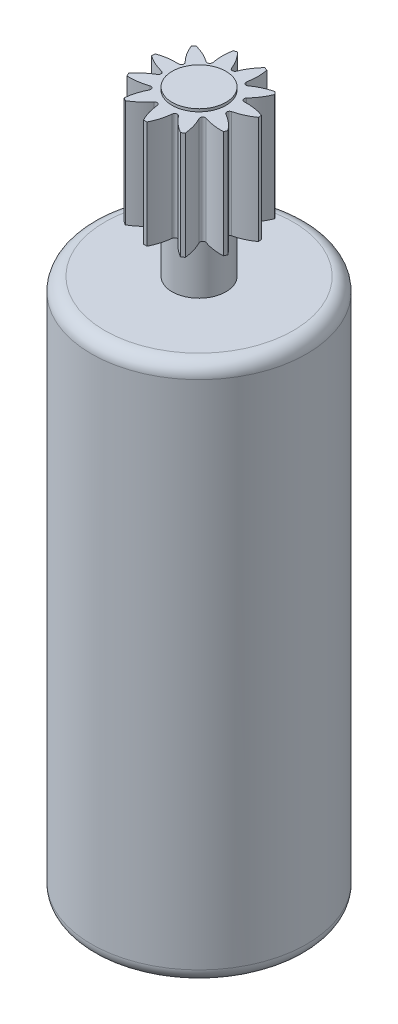
from build123d import *

# Parameters (mm, degrees)
FILLET1_R          = 0.5
CUT_EXTRUDE1_START = -4
CUT_EXTRUDE1_DEPTH = 4
CIRPATTERN2_COUNT  = 11


with BuildPart() as part:
    # Sketch1 → Revolve1 (revolve)
    with BuildSketch(Plane.XY, mode=Mode.PRIVATE) as revolve1_sk:
        Polygon((0, 0), (0, 26.1), (1, 26.1), (1, 26), (2, 26), (2, 22), (1, 22), (1, 20), (4, 20), (4, 0), align=None)
    revolve(revolve1_sk.sketch.rotate(Axis((0, 0, 0), (0, 1, 0)), 90), axis=Axis((0, 0, 0), (0, 1, 0)))

    # Fillet1
    fillet1_edges = [part.edges().sort_by_distance(p)[0] for p in [
        (0, 20, 4),
        (0, 0, 4),
    ]]
    fillet(fillet1_edges, radius=FILLET1_R)

    # Sketch2 → Cut-Extrude1 (cut)
    with BuildSketch(Plane(origin=(0, 26, 0), x_dir=(1, 0, 0), z_dir=(0, 1, 0)).offset(CUT_EXTRUDE1_START)):
        with BuildLine():
            ThreePointArc((-0.5, 1.936491673), (-0.266119458, 1.637619869), (-0.092905413, 1.299949383))
            ThreePointArc((-0.092905413, 1.299949383), (0, 1.236943764), (0.092905413, 1.299949383))
            ThreePointArc((0.092905413, 1.299949383), (0.266119458, 1.637619869), (0.5, 1.936491673))
            ThreePointArc((0.5, 1.936491673), (0, 2), (-0.5, 1.936491673))
        make_face()
    cut_extrude1 = extrude(amount=CUT_EXTRUDE1_DEPTH, mode=Mode.SUBTRACT)

    # CirPattern2: Cut-Extrude1 ×11 about axis
    cirpattern2_axis = Axis((0, 0, 0), (0, 1, 0))
    for i in range(1, CIRPATTERN2_COUNT):
        add(cut_extrude1.rotate(cirpattern2_axis, i * 360 / CIRPATTERN2_COUNT), mode=Mode.SUBTRACT)


solid = part.part
